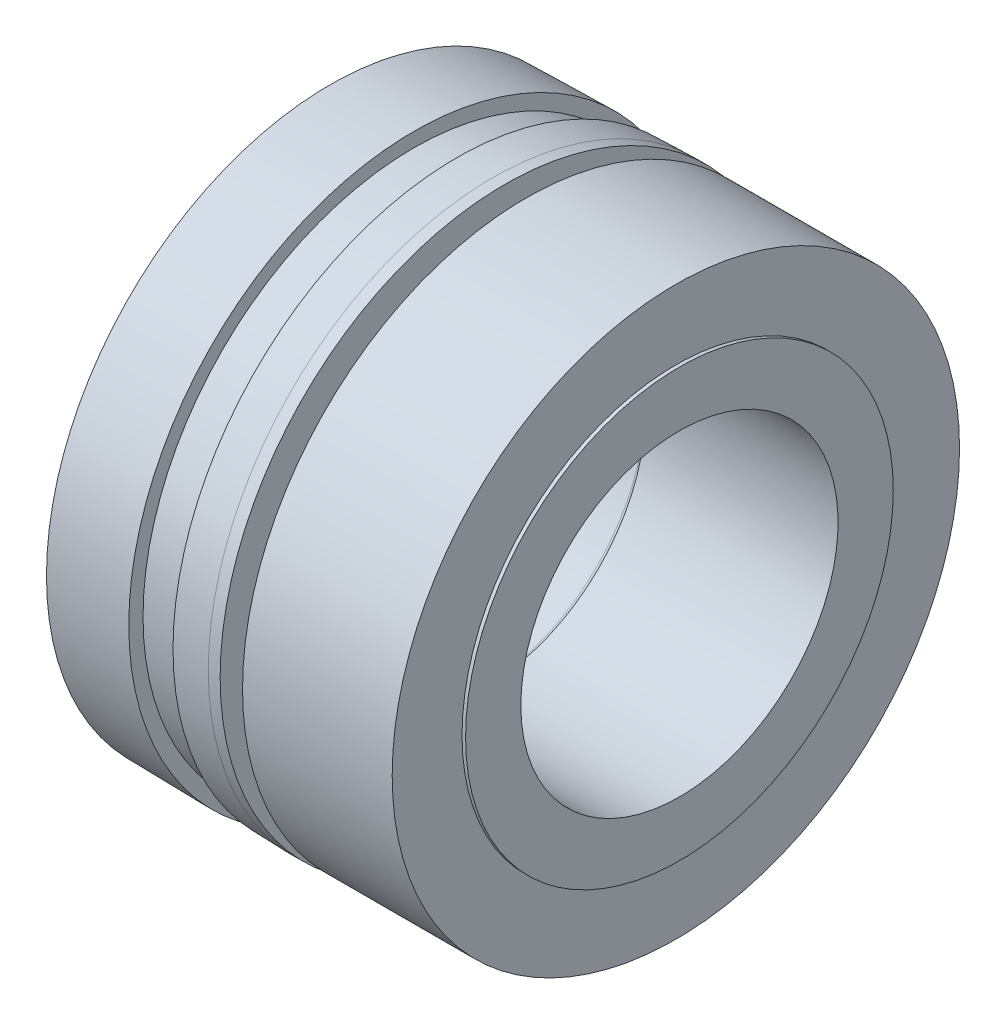
from build123d import *


with BuildPart() as part:
    # Sketch1 → Revolve1 (revolve)
    with BuildSketch(Plane.XY, mode=Mode.PRIVATE) as revolve1_sk:
        with BuildLine():
            Line((-15.367932956, -22.25), (11.632067044, -22.25))
            Line((11.632067044, -22.25), (11.632067044, -30))
            Line((11.632067044, -30), (11.132067044, -30))
            Line((11.132067044, -30), (11.132067044, -39.794883762))
            Line((11.132067044, -39.794883762), (-9.863295576, -39.794883762))
            Line((-9.863295576, -39.794883762), (-9.863295576, -35))
            Line((-9.863295576, -35), (-12.863295576, -35))
            Line((-12.863295576, -35), (-12.863295576, -39.936502505))
            Line((-12.863295576, -39.936502505), (-14.531334037, -39.936502505))
            Line((-14.531334037, -39.936502505), (-19.616831546, -39.794883762))
            Line((-19.616831546, -39.794883762), (-19.616831546, -38))
            Line((-19.616831546, -38), (-25.616831546, -38))
            Line((-25.616831546, -38), (-25.616831546, -40))
            Line((-25.616831546, -40), (-37.367932956, -39.794883762))
            Line((-37.367932956, -39.794883762), (-37.367932956, -33.332032388))
            Line((-37.367932956, -33.332032388), (-34.467915466, -33.332032388))
            Line((-34.467915466, -33.332032388), (-34.467915466, -34.832032388))
            Line((-34.467915466, -34.832032388), (-32.967915466, -34.832032388))
            Line((-32.967915466, -34.832032388), (-32.967915466, -33.332032388))
            Line((-32.967915466, -33.332032388), (-24.363295576, -33.332032388))
            ThreePointArc((-24.363295576, -33.332032388), (-22.241975232, -32.453352732), (-21.363295576, -30.332032388))
            Line((-21.363295576, -30.332032388), (-21.363295576, -23.24536262))
            Line((-21.363295576, -23.24536262), (-16.363295576, -23.24536262))
            ThreePointArc((-16.363295576, -23.24536262), (-15.659467917, -22.953827658), (-15.367932956, -22.25))
        make_face()
    revolve(revolve1_sk.sketch.rotate(Axis((-66.026476718, 0, 0), (1, 0, 0)), 270), axis=Axis((-66.026476718, 0, 0), (1, 0, 0)))


solid = part.part
